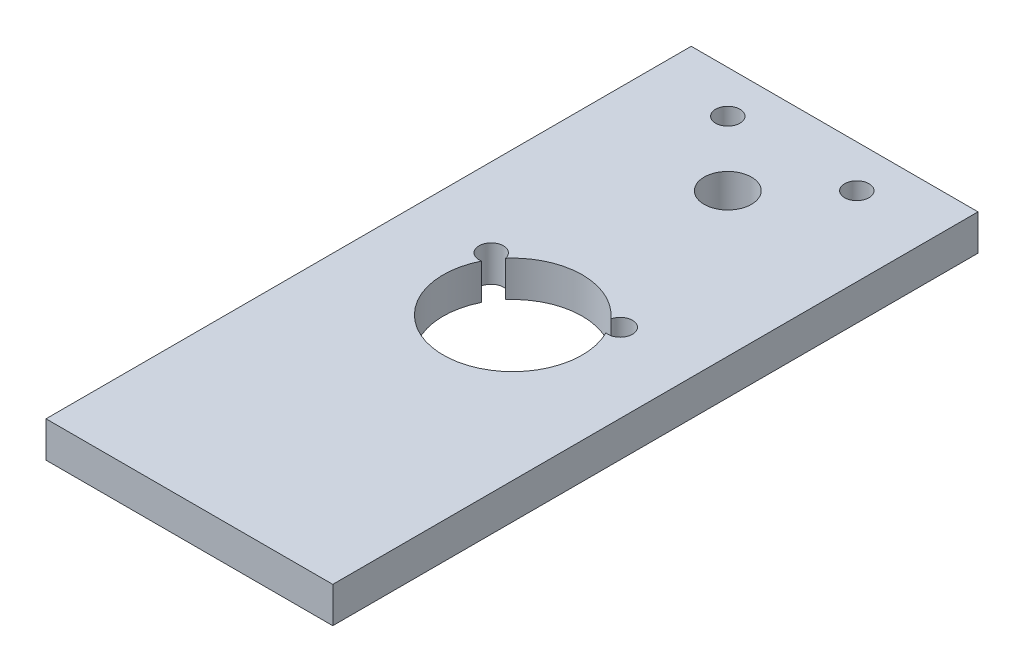
from build123d import *

# Parameters (mm, degrees)
SKETCH2_W           = 40
SKETCH2_H           = 90
BOSS_EXTRUDE1_DEPTH = 5
SKETCH3_R           = 3.3
SKETCH3_R_2         = 9.7
CUT_EXTRUDE1_DEPTH  = 99.615414617
SKETCH5_R           = 1.7
CUT_EXTRUDE2_DEPTH  = 99.615414617


with BuildPart() as part:
    # Sketch2 → Boss-Extrude1 (new body)
    with BuildSketch(Plane(origin=(0, 0, 0), x_dir=(1, 0, 0), z_dir=(0, 1, 0))):
        with Locations((20, 45)):
            Rectangle(SKETCH2_W, SKETCH2_H)
    extrude(amount=BOSS_EXTRUDE1_DEPTH)

    # Sketch3 → Cut-Extrude1 (cut, through all)
    with BuildSketch(Plane(origin=(0, 5, 0), x_dir=(1, 0, 0), z_dir=(0, 1, 0))):
        with Locations(Location((20, 75.1, 0), (0, 0, 270))):
            Circle(SKETCH3_R)
        with Locations(Location((20, 45.1, 0), (0, 0, 270))):
            Circle(SKETCH3_R_2)
    extrude(amount=-CUT_EXTRUDE1_DEPTH, mode=Mode.SUBTRACT)

    # Sketch5 → Cut-Extrude2 (cut, through all)
    with BuildSketch(Plane(origin=(0, 5, 0), x_dir=(1, 0, 0), z_dir=(0, 1, 0))):
        with Locations(Location((11, 84.1, 0), (0, 0, 270))):
            Circle(SKETCH5_R)
        with Locations((11, 51.1)):
            Circle(SKETCH5_R)
    cut_extrude2 = extrude(amount=-CUT_EXTRUDE2_DEPTH, mode=Mode.SUBTRACT)

    # Mirror1: Cut-Extrude2 across plane
    add(cut_extrude2.mirror(Plane(origin=(20, 0, 0), x_dir=(0, 0, 1), z_dir=(1, 0, 0))), mode=Mode.SUBTRACT)


solid = part.part
